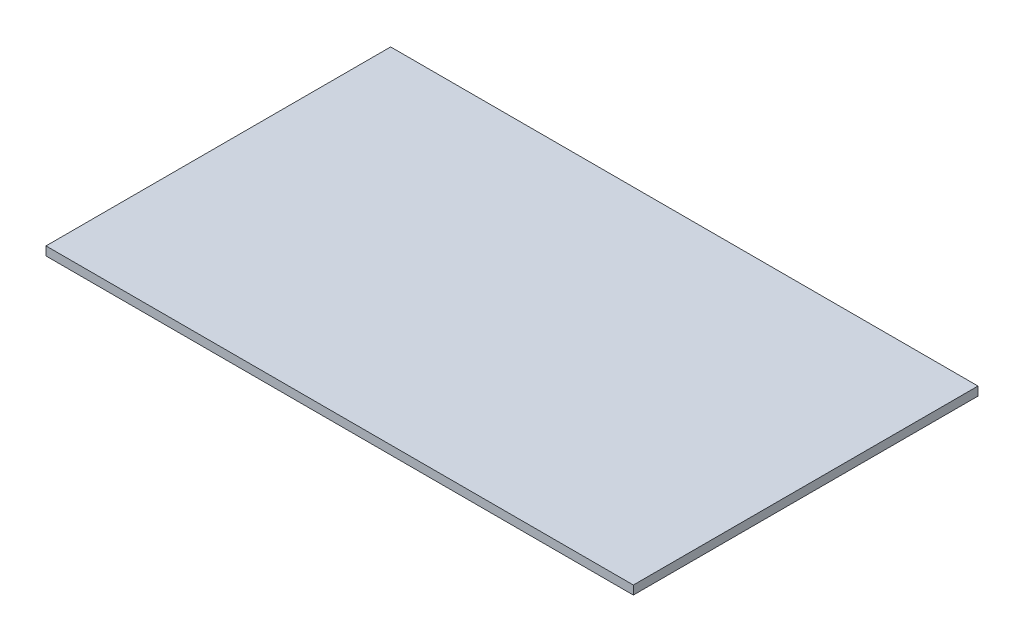
from build123d import *

# Parameters (mm, degrees)
ESQUISSE1_W        = 1210
ESQUISSE1_H        = 710
BOSS_EXTRU_1_DEPTH = 18


with BuildPart() as part:
    # Esquisse1 → Boss.-Extru.1 (new body)
    with BuildSketch(Plane(origin=(0, 0, 0), x_dir=(1, 0, 0), z_dir=(0, 1, 0))):
        Rectangle(ESQUISSE1_W, ESQUISSE1_H)
    extrude(amount=BOSS_EXTRU_1_DEPTH)


solid = part.part
